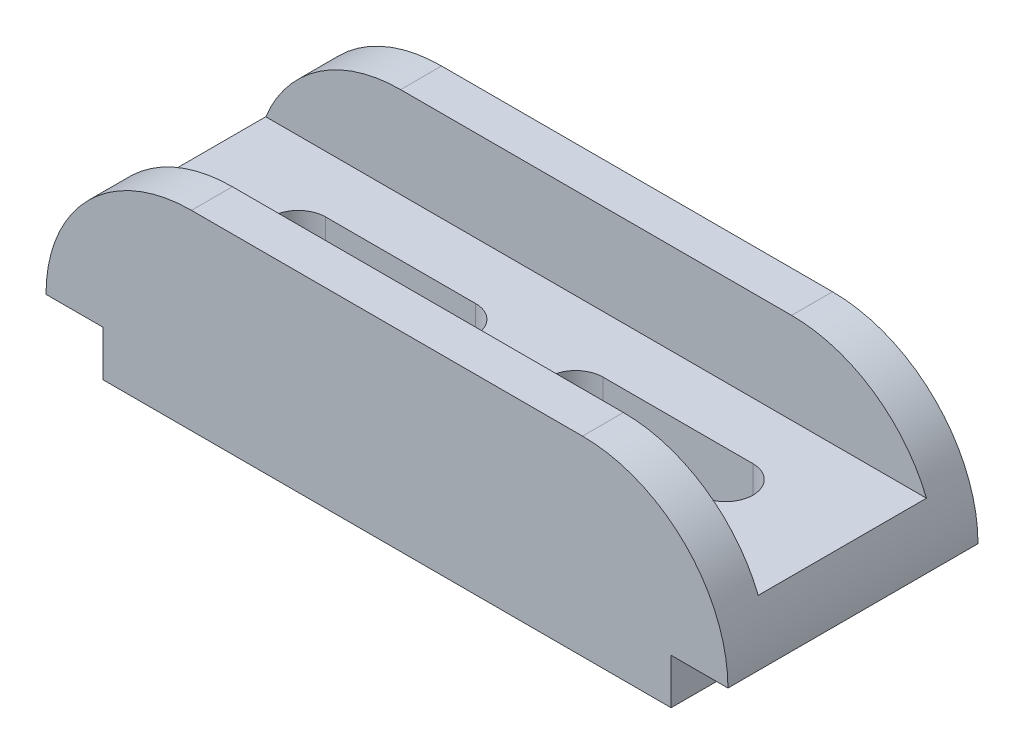
from build123d import *

# Parameters (mm, degrees)
BOSS_EXTRUDE1_DEPTH     = 27.5
CUT_EXTRUDE1_DEPTH      = 91.251038775
CUT_EXTRUDE1_DEPTH_BACK = 91.251038775
SKETCH3_W               = 37
SKETCH3_H               = 20
CUT_EXTRUDE2_REACH      = 92.251


with BuildPart() as part:
    # Sketch1 → Boss-Extrude1 (new, symmetric)
    with BuildSketch(Plane.XY):
        with BuildLine():
            Line((-62.5, 0), (62.5, 0))
            Line((62.5, 0), (62.5, 10))
            Line((62.5, 10), (75, 10))
            ThreePointArc((75, 10), (65.627416998, 32.627416998), (43, 42))
            Line((43, 42), (-43, 42))
            ThreePointArc((-43, 42), (-65.627416998, 32.627416998), (-75, 10))
            Line((-75, 10), (-62.5, 10))
            Line((-62.5, 10), (-62.5, 0))
        make_face()
    extrude(amount=BOSS_EXTRUDE1_DEPTH, both=True)

    # Sketch3 → Cut-Extrude1 (cut, two sides: drawn at the far end of the back side and taken through both)
    with BuildSketch(Plane(origin=(0, 0, 0), x_dir=(0, 0, -1), z_dir=(1, 0, 0)).offset(-CUT_EXTRUDE1_DEPTH_BACK)):
        with Locations((0, 32)):
            Rectangle(SKETCH3_W, SKETCH3_H)
    extrude(amount=CUT_EXTRUDE1_DEPTH + CUT_EXTRUDE1_DEPTH_BACK, mode=Mode.SUBTRACT)

    # Sketch2 → Cut-Extrude2 (cut, up to next)
    with BuildSketch(Plane(origin=(0, 42, 0), x_dir=(1, 0, 0), z_dir=(0, 1, 0)), mode=Mode.PRIVATE) as cut_extrude2_sk1:
        with BuildLine():
            Line((-14, 6), (-47, 6))
            ThreePointArc((-47, 6), (-53, 0), (-47, -6))
            Line((-47, -6), (-14, -6))
            ThreePointArc((-14, -6), (-8, 0), (-14, 6))
        make_face()
    cut_extrude2_tool1 = extrude(cut_extrude2_sk1.sketch, amount=-CUT_EXTRUDE2_REACH, mode=Mode.PRIVATE) & part.part
    # Sketch2 → Cut-Extrude2 (cut, up to next)
    with BuildSketch(Plane(origin=(0, 42, 0), x_dir=(1, 0, 0), z_dir=(0, 1, 0)), mode=Mode.PRIVATE) as cut_extrude2_sk2:
        with BuildLine():
            Line((14, 6), (47, 6))
            ThreePointArc((47, 6), (53, 0), (47, -6))
            Line((47, -6), (14, -6))
            ThreePointArc((14, -6), (8, 0), (14, 6))
        make_face()
    cut_extrude2_tool2 = extrude(cut_extrude2_sk2.sketch, amount=-CUT_EXTRUDE2_REACH, mode=Mode.PRIVATE) & part.part
    add(cut_extrude2_tool1.solids().sort_by_distance((-30.5, 42, 0))[0], mode=Mode.SUBTRACT)
    add(cut_extrude2_tool2.solids().sort_by_distance((30.5, 42, 0))[0], mode=Mode.SUBTRACT)


solid = part.part
